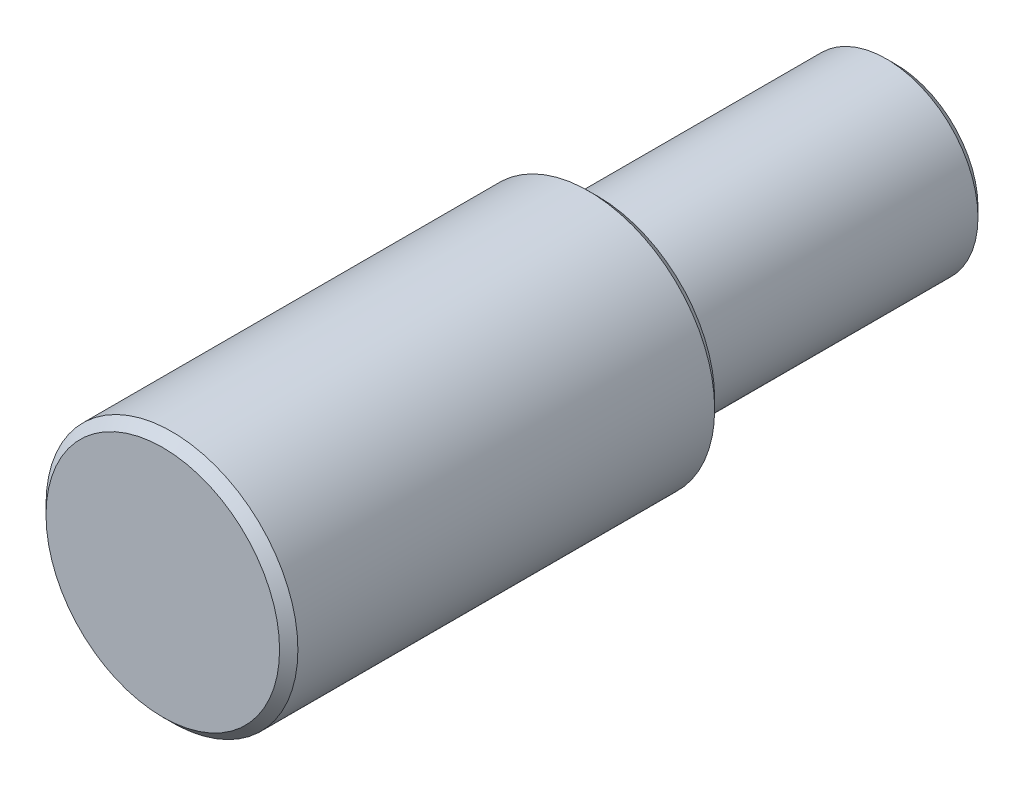
from build123d import *

# Parameters (mm, degrees)
SKETCH_1_R      = 20
EXTRUDE_1_DEPTH = 65
SKETCH_2_R      = 27.5
EXTRUDE_2_DEPTH = 95
CHAMFER_1_SIZE  = 2


with BuildPart() as part:
    # 草图1 → 凸台-拉伸1 (new body)
    with BuildSketch(Plane.XY):
        Circle(SKETCH_1_R)
    extrude(amount=EXTRUDE_1_DEPTH)

    # 草图2 → 凸台-拉伸2 (add)
    with BuildSketch(Plane.XY.offset(65)):
        Circle(SKETCH_2_R)
    extrude(amount=EXTRUDE_2_DEPTH)

    # 倒角1
    chamfer_1_edges = [part.edges().sort_by_distance(p)[0] for p in [
        (-20, 0, 0),
        (-27.5, 0, 65),
        (-27.5, 0, 160),
    ]]
    chamfer(chamfer_1_edges, length=CHAMFER_1_SIZE)


solid = part.part
